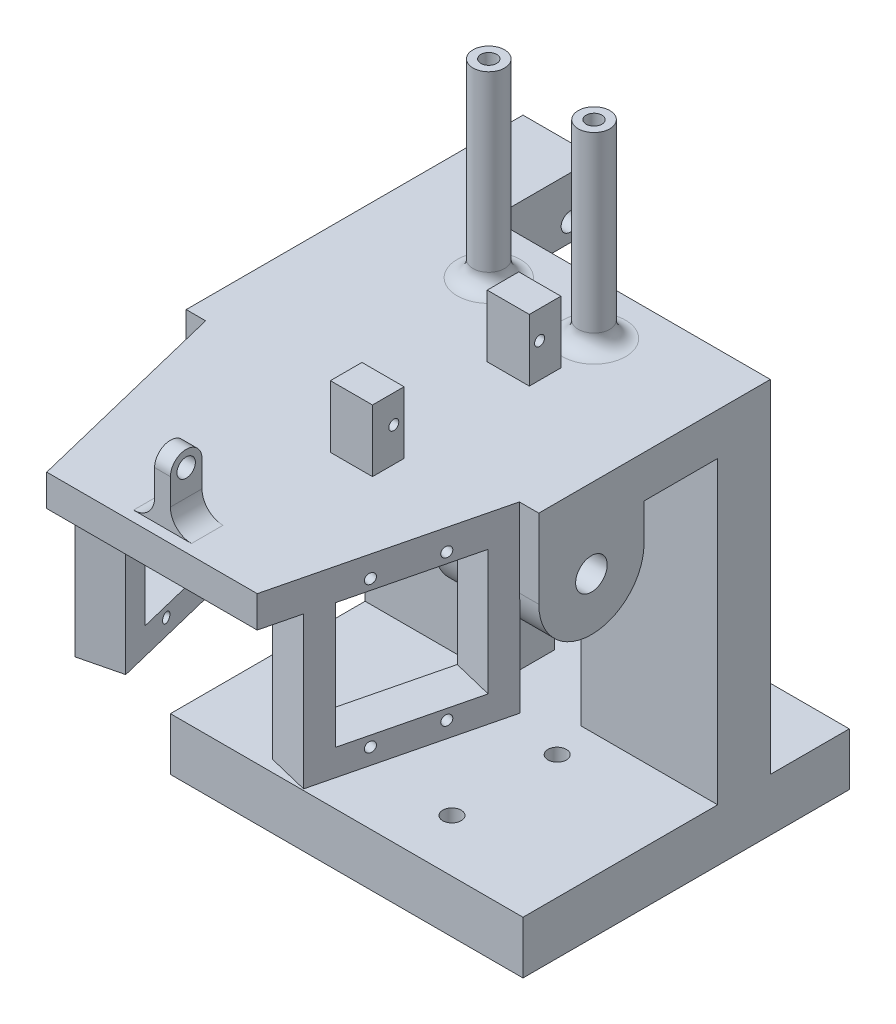
from build123d import *

# Parameters (mm, degrees)
SKETCH_1_W             = 67
SKETCH_1_H             = 62
EXTRUDE_1_DEPTH        = 10
SKETCH_3_W             = 14
SKETCH_3_H             = 20
EXTRUDE_2_DEPTH        = 12.5
SKETCH_4_W             = 10
SKETCH_4_H             = 65
EXTRUDE_3_DEPTH        = 67
SKETCH_5_W             = 67
SKETCH_5_H             = 44
EXTRUDE_4_DEPTH        = 8
EXTRUDE_5_DEPTH        = 20
CUT_EXTRUDE_START      = -6
CUT_EXTRUDE_1_DEPTH    = 8
EXTRUDE_6_DEPTH        = 6
SKETCH_9_R             = 3
CUT_EXTRUDE_2_DEPTH    = 23
SKETCH_10_W            = 24
SKETCH_10_H            = 23.8
EXTRUDE_7_DEPTH        = 8
SKETCH_12_W            = 14
SKETCH_12_H            = 20
EXTRUDE_8_DEPTH        = 11.5
SKETCH_13_R            = 0.95
CUT_EXTRUDE_4_DEPTH    = 8
SKETCH_14_W            = 8
SKETCH_14_H            = 6
EXTRUDE_9_DEPTH        = 11.8
SKETCH_15_R            = 0.95
CUT_EXTRUDE_5_DEPTH    = 11.8
SKETCH_16_W            = 3
SKETCH_16_H            = 6
EXTRUDE_10_DEPTH       = 12
FILLET_1_RADIUS        = 3
FILLET_1_LENGTH        = 3
SKETCH_17_R            = 1.75
CUT_EXTRUDE_6_DEPTH    = 7
SKETCH_18_R            = 3
EXTRUDE_11_DEPTH       = 36
FILLET_2_R             = 3
FILLET_2_OF_MIRROR_1_R = 3
SKETCH_20_R            = 1.75
CUT_EXTRUDE_7_DEPTH    = 35
SKETCH_21_W            = 15
SKETCH_21_H            = 55
CUT_EXTRUDE_8_DEPTH    = 35
SKETCH_24_R            = 1.75
CUT_EXTRUDE_11_DEPTH   = 18
SKETCH_25_R            = 1.5
CUT_EXTRUDE_12_DEPTH   = 10
FILLET_3_R             = 4
SKETCH_26_W            = 10.1
SKETCH_26_H            = 3.75
EXTRUDE_12_DEPTH       = 1
SKETCH_27_R            = 1.4
CUT_EXTRUDE_13_DEPTH   = 4


with BuildPart() as part:
    # 草图1 → 凸台-拉伸1 (new body)
    with BuildSketch(Plane(origin=(0, 0, 0), x_dir=(1, 0, 0), z_dir=(0, 1, 0))):
        Rectangle(SKETCH_1_W, SKETCH_1_H)
    extrude(amount=EXTRUDE_1_DEPTH)

    # 草图3 → 凸台-拉伸2 (add)
    with BuildSketch(Plane(origin=(0, 10, 0), x_dir=(1, 0, 0), z_dir=(0, 1, 0))):
        with Locations((-26.5, 26)):
            Rectangle(SKETCH_3_W, SKETCH_3_H)
    extrude(amount=EXTRUDE_2_DEPTH)

    # 草图4 → 凸台-拉伸3 (add)
    with BuildSketch(Plane.ZY.offset(33.5)):
        with Locations((-11, 42.5)):
            Rectangle(SKETCH_4_W, SKETCH_4_H)
    extrude(amount=-EXTRUDE_3_DEPTH)

    # 草图5 → 凸台-拉伸4 (add)
    with BuildSketch(Plane(origin=(0, 75, 0), x_dir=(1, 0, 0), z_dir=(0, 1, 0))):
        with Locations((0, -6)):
            Rectangle(SKETCH_5_W, SKETCH_5_H)
    extrude(amount=-EXTRUDE_4_DEPTH)

    # 草图6 → 凸台-拉伸5 (add)
    with BuildSketch(Plane(origin=(33.5, 0, 0), x_dir=(0, 0, -1), z_dir=(1, 0, 0))):
        with BuildLine():
            Line((-28, 60), (-28, 67))
            Line((-28, 67), (-8, 67))
            Line((-8, 67), (-8, 60))
            ThreePointArc((-8, 60), (-18, 50), (-28, 60))
        make_face()
    extrude_5 = extrude(amount=-EXTRUDE_5_DEPTH)

    # 草图7 → 切除-拉伸1 (cut)
    with BuildSketch(Plane(origin=(33.5, 0, 0), x_dir=(0, 0, -1), z_dir=(1, 0, 0)).offset(CUT_EXTRUDE_START)):
        with BuildLine():
            Line((-28, 60), (-28, 70.000230089))
            Line((-28, 70.000230089), (-8, 70.000230089))
            Line((-8, 70.000230089), (-8, 60))
            ThreePointArc((-8, 60), (-18, 50), (-28, 60))
        make_face()
    cut_extrude_1 = extrude(amount=-CUT_EXTRUDE_1_DEPTH, mode=Mode.SUBTRACT)

    # 草图8 → 凸台-拉伸6 (add)
    with BuildSketch(Plane(origin=(0, 75, 0), x_dir=(1, 0, 0), z_dir=(0, 1, 0))):
        Polygon((0, -68), (20, -68), (29.804375739, -28), (0, -28), align=None)
    extrude_6 = extrude(amount=-EXTRUDE_6_DEPTH)

    # 草图9 → 切除-拉伸2 (cut)
    with BuildSketch(Plane(origin=(33.5, 0, 0), x_dir=(0, 0, -1), z_dir=(1, 0, 0))):
        with Locations((-18, 60)):
            Circle(SKETCH_9_R)
    cut_extrude_2 = extrude(amount=-CUT_EXTRUDE_2_DEPTH, mode=Mode.SUBTRACT)

    # 草图10 → 凸台-拉伸7 (add)
    with BuildSketch(Plane(origin=(34.589358039, 0, 8.47817657), x_dir=(0.23806246083963745, 0, -0.9712498467124595), z_dir=(0.9712498467124595, 0, 0.23806246083963745))):
        Polygon((-49, 75), (-20, 75), (-20, 40.2), (-48, 40.2), (-54, 40.2), (-54, 75), align=None)
        with Locations((-37, 57.1)):
            Rectangle(SKETCH_10_W, SKETCH_10_H, mode=Mode.SUBTRACT)
    extrude_7 = extrude(amount=-EXTRUDE_7_DEPTH)

    # 草图12 → 凸台-拉伸8 (add)
    with BuildSketch(Plane(origin=(0, 75, 0), x_dir=(1, 0, 0), z_dir=(0, 1, 0))):
        with Locations((-26.5, 26)):
            Rectangle(SKETCH_12_W, SKETCH_12_H)
    extrude(amount=-EXTRUDE_8_DEPTH)

    # 草图13 → 切除-拉伸4 (cut)
    with BuildSketch(Plane(origin=(26.819359266, 0, 6.573676883), x_dir=(-0.23806246083963745, 0, 0.9712498467124595), z_dir=(-0.9712498467124595, 0, -0.23806246083963745))):
        with Locations((43.5, 70.95)):
            Circle(SKETCH_13_R)
        with Locations((31.5, 70.95)):
            Circle(SKETCH_13_R)
        with Locations((31.5, 43.25)):
            Circle(SKETCH_13_R)
        with Locations((43.5, 43.25)):
            Circle(SKETCH_13_R)
    cut_extrude_4 = extrude(amount=-CUT_EXTRUDE_4_DEPTH, mode=Mode.SUBTRACT)

    # 草图14 → 凸台-拉伸9 (add)
    with BuildSketch(Plane(origin=(0, 75, 0), x_dir=(1, 0, 0), z_dir=(0, 1, 0))):
        with Locations((7.7, -5)):
            Rectangle(SKETCH_14_W, SKETCH_14_H)
        with Locations((7.7, -34.8)):
            Rectangle(SKETCH_14_W, SKETCH_14_H)
    extrude(amount=EXTRUDE_9_DEPTH)

    # 草图15 → 切除-拉伸5 (cut)
    with BuildSketch(Plane.ZY.offset(-3.7)):
        with Locations((33.75, 81.5)):
            Circle(SKETCH_15_R)
        with Locations((6.05, 81.5)):
            Circle(SKETCH_15_R)
    extrude(amount=-CUT_EXTRUDE_5_DEPTH, mode=Mode.SUBTRACT)

    # 草图16 → 凸台-拉伸10 (add)
    with BuildSketch(Plane(origin=(0, 75, 0), x_dir=(1, 0, 0), z_dir=(0, 1, 0))):
        with Locations((0, -63)):
            Rectangle(SKETCH_16_W, SKETCH_16_H)
    extrude(amount=EXTRUDE_10_DEPTH)

    # 圆角1: full round fillet: the end face becomes a half cylinder, R = half its width
    fillet_1_face = Plane((0, 87, 63), x_dir=(1, 0, 0), z_dir=(0, 1, 0))  # on the end face: x along it, z out of the body
    fillet_1_slab = fillet_1_face.offset(-FILLET_1_RADIUS / 2) * Box(FILLET_1_LENGTH, 2 * FILLET_1_RADIUS, FILLET_1_RADIUS, mode=Mode.PRIVATE)  # the body's end, R deep
    fillet_1_round = Plane((0, 84, 63), x_dir=(0, 1, 0), z_dir=(1, 0, 0)) * Cylinder(FILLET_1_RADIUS, FILLET_1_LENGTH, mode=Mode.PRIVATE)  # its axis R under the face
    add(fillet_1_slab - fillet_1_round, mode=Mode.SUBTRACT)

    # 草图17 → 切除-拉伸6 (cut)
    with BuildSketch(Plane.ZY.offset(1.5)):
        with Locations((63, 84)):
            Circle(SKETCH_17_R)
    extrude(amount=-CUT_EXTRUDE_6_DEPTH, mode=Mode.SUBTRACT)

    # 草图18 → 凸台-拉伸11 (add)
    with BuildSketch(Plane(origin=(0, 75, 0), x_dir=(1, 0, 0), z_dir=(0, 1, 0))):
        with Locations(Location((10, 6, 0), (0, 0, 270))):
            Circle(SKETCH_18_R)
    extrude_11 = extrude(amount=EXTRUDE_11_DEPTH)

    # 圆角2
    fillet_2_edges = [part.edges().sort_by_distance(p)[0] for p in [
        (10, 75, -9),
    ]]
    fillet(fillet_2_edges, radius=FILLET_2_R)

    # 镜向1: 凸台-拉伸5, 切除-拉伸1, 凸台-拉伸6, 切除-拉伸2, 凸台-拉伸7, 切除-拉伸4, 凸台-拉伸11 across plane
    add(extrude_5.mirror(Plane(origin=(0, 0, 0), x_dir=(0, 0, 1), z_dir=(1, 0, 0))))
    add(cut_extrude_1.mirror(Plane(origin=(0, 0, 0), x_dir=(0, 0, 1), z_dir=(1, 0, 0))), mode=Mode.SUBTRACT)
    add(extrude_6.mirror(Plane(origin=(0, 0, 0), x_dir=(0, 0, 1), z_dir=(1, 0, 0))))
    add(cut_extrude_2.mirror(Plane(origin=(0, 0, 0), x_dir=(0, 0, 1), z_dir=(1, 0, 0))), mode=Mode.SUBTRACT)
    add(extrude_7.mirror(Plane(origin=(0, 0, 0), x_dir=(0, 0, 1), z_dir=(1, 0, 0))))
    add(cut_extrude_4.mirror(Plane(origin=(0, 0, 0), x_dir=(0, 0, 1), z_dir=(1, 0, 0))), mode=Mode.SUBTRACT)
    add(extrude_11.mirror(Plane(origin=(0, 0, 0), x_dir=(0, 0, 1), z_dir=(1, 0, 0))))

    # 圆角2 of 镜向1
    fillet_2_of_mirror_1_edges = [part.edges().sort_by_distance(p)[0] for p in [
        (-10, 75, -9),
    ]]
    fillet(fillet_2_of_mirror_1_edges, radius=FILLET_2_OF_MIRROR_1_R)

    # 草图20 → 切除-拉伸7 (cut)
    with BuildSketch(Plane.ZY.offset(33.5)):
        with Locations((-31, 67)):
            Circle(SKETCH_20_R)
        with Locations((-21, 67)):
            Circle(SKETCH_20_R)
        with Locations((-31, 19)):
            Circle(SKETCH_20_R)
        with Locations((-21, 19)):
            Circle(SKETCH_20_R)
    extrude(amount=-CUT_EXTRUDE_7_DEPTH, mode=Mode.SUBTRACT)

    # 草图21 → 切除-拉伸8 (cut)
    with BuildSketch(Plane(origin=(0, 0, -16), x_dir=(-1, 0, 0), z_dir=(0, 0, -1))):
        with Locations((0, 37.5)):
            Rectangle(SKETCH_21_W, SKETCH_21_H)
    extrude(amount=-CUT_EXTRUDE_8_DEPTH, mode=Mode.SUBTRACT)

    # 草图24 → 切除-拉伸11 (cut)
    with BuildSketch(Plane(origin=(0, 10, 0), x_dir=(1, 0, 0), z_dir=(0, 1, 0))):
        with Locations(Location((-10, -21, 0), (0, 0, 270))):
            Circle(SKETCH_24_R)
        with Locations(Location((10, -21, 0), (0, 0, 270))):
            Circle(SKETCH_24_R)
        with Locations(Location((-10, -1, 0), (0, 0, 270))):
            Circle(SKETCH_24_R)
        with Locations(Location((10, -1, 0), (0, 0, 270))):
            Circle(SKETCH_24_R)
    extrude(amount=-CUT_EXTRUDE_11_DEPTH, mode=Mode.SUBTRACT)

    # 草图25 → 切除-拉伸12 (cut)
    with BuildSketch(Plane(origin=(0, 111, 0), x_dir=(1, 0, 0), z_dir=(0, 1, 0))):
        with Locations(Location((10, 6, 0), (0, 0, 270))):
            Circle(SKETCH_25_R)
        with Locations(Location((-10, 6, 0), (0, 0, 270))):
            Circle(SKETCH_25_R)
    extrude(amount=-CUT_EXTRUDE_12_DEPTH, mode=Mode.SUBTRACT)

    # 圆角3
    fillet_3_edges = [part.edges().sort_by_distance(p)[0] for p in [
        (-1.5, 75, 63),
        (1.5, 75, 63),
    ]]
    fillet(fillet_3_edges, radius=FILLET_3_R)

    # 草图26 → 凸台-拉伸12 (add)
    with BuildSketch(Plane.XZ.offset(-69)):
        with Locations((0.05, 62.025)):
            Rectangle(SKETCH_26_W, SKETCH_26_H)
    extrude(amount=EXTRUDE_12_DEPTH)

    # 草图27 → 切除-拉伸13 (cut)
    with BuildSketch(Plane.XZ.offset(-68)):
        with Locations(Location((0, 62, 0), (0, 0, 270))):
            Circle(SKETCH_27_R)
    extrude(amount=-CUT_EXTRUDE_13_DEPTH, mode=Mode.SUBTRACT)


solid = part.part
